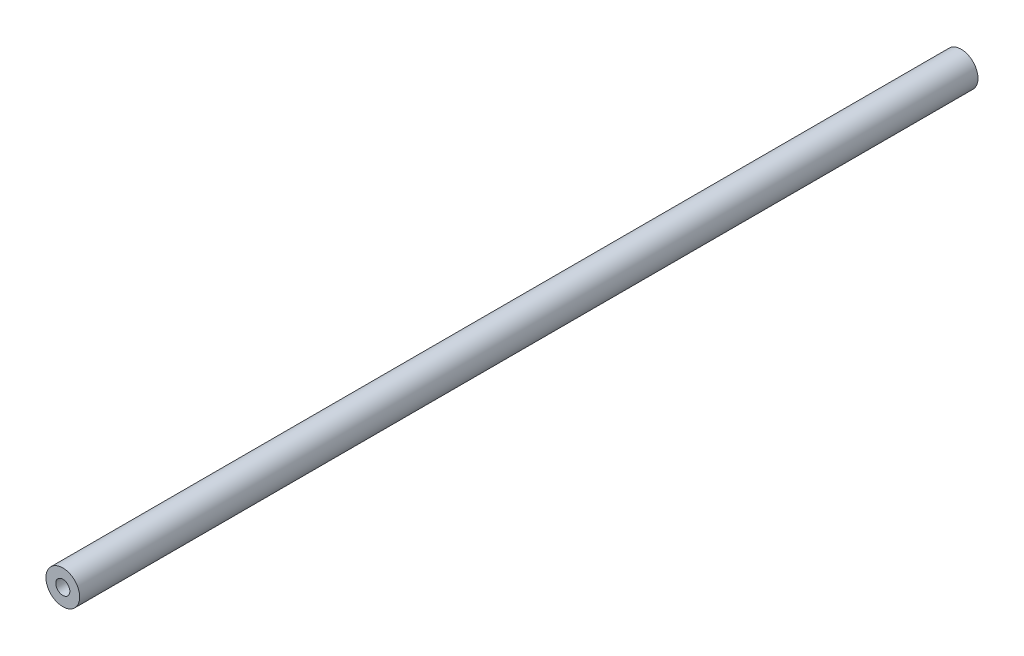
from build123d import *

# Parameters (mm, degrees)
SKETCH_1_R          = 6
SKETCH_1_R_2        = 0.0005
EXTRUDE_1_DEPTH     = 320
SKETCH_2_R          = 2.5
CUT_EXTRUDE_1_DEPTH = 321.112480232


with BuildPart() as part:
    # 草图1 → 凸台-拉伸1 (new body)
    with BuildSketch(Plane.XY):
        Circle(SKETCH_1_R)
        Circle(SKETCH_1_R_2, mode=Mode.SUBTRACT)
    extrude(amount=-EXTRUDE_1_DEPTH)

    # 草图2 → 切除-拉伸1 (cut, through all)
    with BuildSketch(Plane.XY):
        Circle(SKETCH_2_R)
    extrude(amount=-CUT_EXTRUDE_1_DEPTH, mode=Mode.SUBTRACT)


solid = part.part
